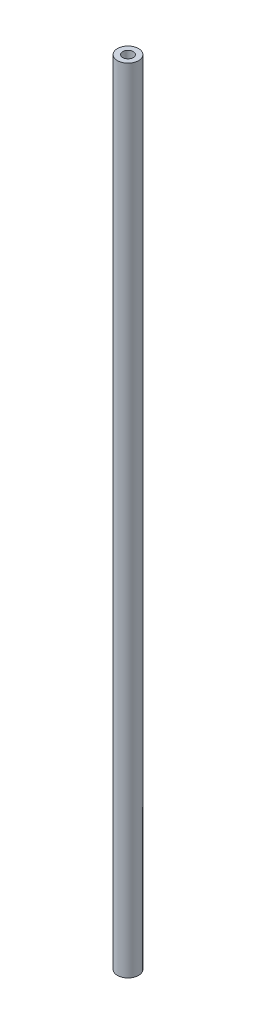
from build123d import *

# Parameters (mm, degrees)
SKETCH1_R           = 7
BOSS_EXTRUDE1_DEPTH = 527.5
SKETCH2_R           = 3.5
CUT_EXTRUDE1_DEPTH  = 528.592882818


with BuildPart() as part:
    # Sketch1 → Boss-Extrude1 (new body)
    with BuildSketch(Plane(origin=(0, 0, 0), x_dir=(1, 0, 0), z_dir=(0, 1, 0))):
        with Locations(Location((0, 0, 0), (0, 0, 270))):
            Circle(SKETCH1_R)
    extrude(amount=BOSS_EXTRUDE1_DEPTH)

    # Sketch2 → Cut-Extrude1 (cut, through all)
    with BuildSketch(Plane(origin=(0, 527.5, 0), x_dir=(1, 0, 0), z_dir=(0, 1, 0))):
        with Locations(Location((0, 0, 0), (0, 0, 270))):
            Circle(SKETCH2_R)
    extrude(amount=-CUT_EXTRUDE1_DEPTH, mode=Mode.SUBTRACT)


solid = part.part
